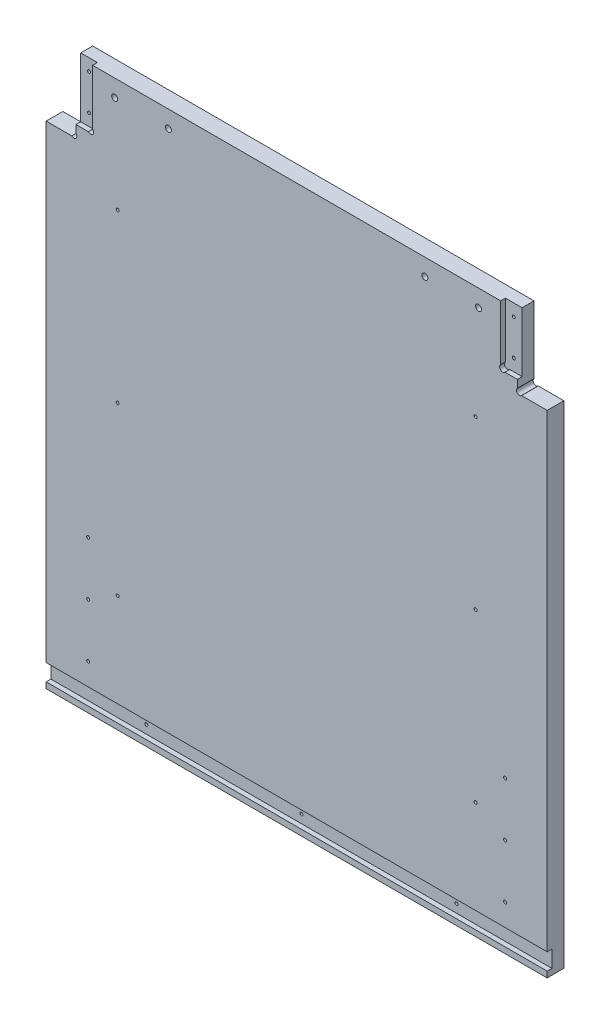
from build123d import *

# Parameters (mm, degrees)
EXTRUDE1_DEPTH     = 17.78
SKETCH4_R          = 3.175
SKETCH4_R_2        = 3.175000003
CUT_EXTRUDE1_DEPTH = 17.78
SKETCH6_R          = 1.5875
CUT_EXTRUDE3_DEPTH = 17.78
SKETCH5_W          = 17.78
SKETCH5_H          = 63.50740041
SKETCH5_H_2        = 63.507400408
CUT_EXTRUDE2_DEPTH = 5.08
SKETCH7_R          = 3.302
CUT_EXTRUDE4_DEPTH = 5.08
SKETCH9_R          = 3.175
CUT_EXTRUDE5_DEPTH = 17.78


with BuildPart() as part:
    # Sketch3 → Extrude1 (new body)
    with BuildSketch(Plane.XY):
        Polygon((10806.641666666, -6342.0625), (11340.041666666, -6342.0625), (11340.041666666, -5818.73683858), (11312.781794728, -5818.73683858), (11308.291666667, -5814.246710519), (11308.291666667, -5742.536838581), (10838.391666667, -5742.536838581), (10838.391666667, -5814.246710519), (10833.901538605, -5818.736838581), (10806.641666666, -5818.736838581), align=None)
    extrude(amount=-EXTRUDE1_DEPTH)

    # Sketch4 → Cut-Extrude1 (cut)
    with BuildSketch(Plane.XY):
        with Locations((11310.536730697, -5816.49177455)):
            Circle(SKETCH4_R)
        with Locations((10836.146602636, -5816.49177455)):
            Circle(SKETCH4_R_2)
    extrude(amount=-CUT_EXTRUDE1_DEPTH, mode=Mode.SUBTRACT)

    # Sketch6 → Cut-Extrude3 (cut)
    with BuildSketch(Plane.XY):
        with Locations((10851.409166666, -6294.4375)):
            Circle(SKETCH6_R)
        with Locations((10908.241666666, -6326.8225)):
            Circle(SKETCH6_R)
        with Locations((11073.341666666, -6326.8225)):
            Circle(SKETCH6_R)
        with Locations((11238.441666666, -6326.8225)):
            Circle(SKETCH6_R)
        with Locations((11295.274166666, -6294.4375)):
            Circle(SKETCH6_R)
        with Locations((11295.274166666, -6237.2875)):
            Circle(SKETCH6_R)
        with Locations((11263.841666666, -6218.2375)):
            Circle(SKETCH6_R)
        with Locations((11295.274166666, -6180.1375)):
            Circle(SKETCH6_R)
        with Locations((11263.841666666, -6040.4375)):
            Circle(SKETCH6_R)
        with Locations((11263.841666666, -5862.6375)):
            Circle(SKETCH6_R)
        with Locations((11299.401666666, -5793.344238991)):
            Circle(SKETCH6_R)
        with Locations((11299.401666666, -5755.236838581)):
            Circle(SKETCH6_R)
        with Locations((10847.281666666, -5755.236838581)):
            Circle(SKETCH6_R)
        with Locations((10847.281666666, -5793.344238991)):
            Circle(SKETCH6_R)
        with Locations((10882.841666666, -6040.4375)):
            Circle(SKETCH6_R)
        with Locations((10851.409166666, -6180.1375)):
            Circle(SKETCH6_R)
        with Locations((10882.841666666, -6218.2375)):
            Circle(SKETCH6_R)
        with Locations((10851.409166666, -6237.2875)):
            Circle(SKETCH6_R)
        with Locations((10882.841666666, -5862.6375)):
            Circle(SKETCH6_R)
    extrude(amount=-CUT_EXTRUDE3_DEPTH, mode=Mode.SUBTRACT)

    # Sketch5 → Cut-Extrude2 (cut)
    with BuildSketch(Plane.XY):
        Polygon((11073.341666666, -6317.9325), (10806.641666666, -6317.9325), (10806.641666666, -6335.7125), (11340.041666666, -6335.7125), (11340.041666666, -6317.9325), align=None)
        with Locations((10847.281666667, -5774.290538786)):
            Rectangle(SKETCH5_W, SKETCH5_H)
        with Locations((11299.401666667, -5774.290538785)):
            Rectangle(SKETCH5_W, SKETCH5_H_2)
    extrude(amount=-CUT_EXTRUDE2_DEPTH, mode=Mode.SUBTRACT)

    # Sketch7 → Cut-Extrude4 (cut)
    with BuildSketch(Plane.XY):
        with Locations((10853.926602637, -5803.79917496)):
            Circle(SKETCH7_R)
        with Locations((11292.756730697, -5803.799174959)):
            Circle(SKETCH7_R)
    extrude(amount=-CUT_EXTRUDE4_DEPTH, mode=Mode.SUBTRACT)

    # Sketch9 → Cut-Extrude5 (cut)
    with BuildSketch(Plane.XY):
        with Locations((10879.616654067, -5760.644320781)):
            Circle(SKETCH9_R)
        with Locations((10936.816666667, -5760.644320781)):
            Circle(SKETCH9_R)
        with Locations((11209.816654067, -5760.644320781)):
            Circle(SKETCH9_R)
        with Locations((11267.016666667, -5760.644320781)):
            Circle(SKETCH9_R)
    extrude(amount=-CUT_EXTRUDE5_DEPTH, mode=Mode.SUBTRACT)


solid = part.part
